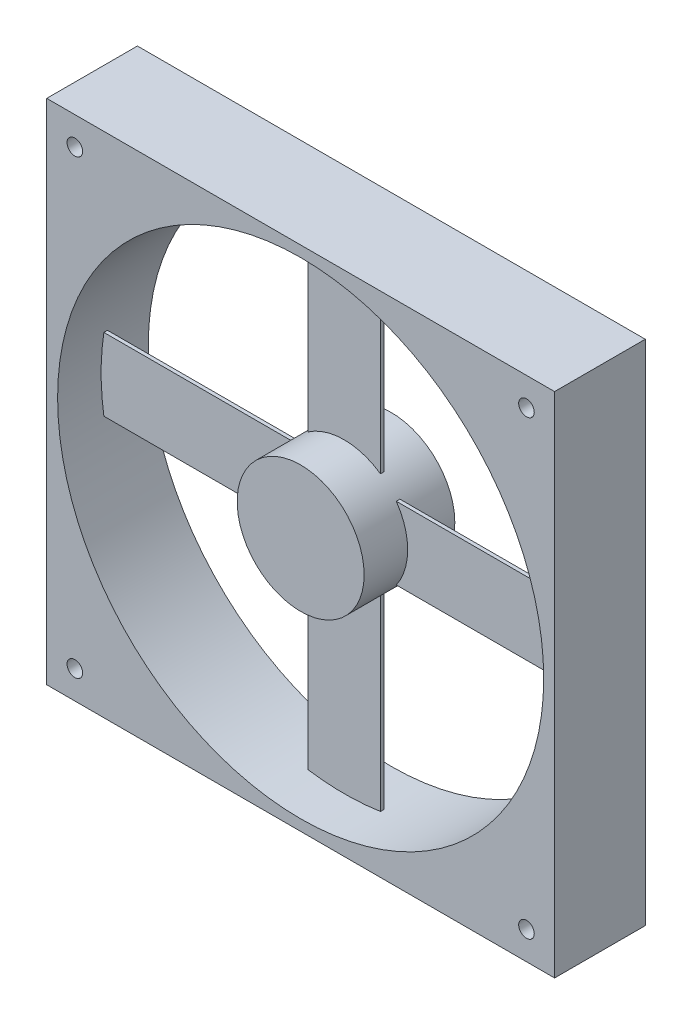
from build123d import *
from build123d.topology import SkipClean

# Parameters (mm, degrees)
SKICA1_W                 = 140
SKICA1_H                 = 140
P_IDAT_VYSUNUT_M1_DEPTH  = 25
SKICA2_R                 = 2.15
ODEBRAT_VYSUNUT_M1_DEPTH = 103.102889283
SKICA3_R                 = 67
SKICA3_R_2               = 17.5
ODEBRAT_VYSUNUT_M3_DEPTH = 103.102889283
P_IDAT_VYSUNUT_M2_DEPTH  = 0.5


with BuildPart() as part:
    # Skica1 → Přidat vysunutím1 (new body)
    with BuildSketch(Plane.XY):
        Rectangle(SKICA1_W, SKICA1_H)
    extrude(amount=P_IDAT_VYSUNUT_M1_DEPTH)

    # Skica2 → Odebrat vysunutím1 (cut, through all)
    with BuildSketch(Plane.XY.offset(25)):
        with Locations((-62.25, 62.25)):
            Circle(SKICA2_R)
        with Locations((-62.25, -62.25)):
            Circle(SKICA2_R)
        with Locations((62.25, -62.25)):
            Circle(SKICA2_R)
        with Locations((62.25, 62.25)):
            Circle(SKICA2_R)
    extrude(amount=-ODEBRAT_VYSUNUT_M1_DEPTH, mode=Mode.SUBTRACT)

    # Skica3 → Odebrat vysunutím3 (cut, through all)
    with BuildSketch(Plane.XY.offset(25)):
        Circle(SKICA3_R)
        Circle(SKICA3_R_2, mode=Mode.SUBTRACT)
    extrude(amount=-ODEBRAT_VYSUNUT_M3_DEPTH, mode=Mode.SUBTRACT)


with BuildPart() as odebrat_vysunut_m3_piece_1:
    # of the separate pieces the step leaves, piece 1, a body of its own (odebrat_vysunut_m3_pieces)
    add(part.part.solids().sort_by_distance((-70, 70, 0))[0])



with BuildPart() as odebrat_vysunut_m3_piece_2:
    # of the separate pieces the step leaves, piece 2, a body of its own (odebrat_vysunut_m3_pieces)
    add(part.part.solids().sort_by_distance((17.5, 0, 0))[0])


with BuildPart() as odebrat_vysunut_m3_piece_1_1:
    with SkipClean():  # the faces are left unmerged after this step: merging them gives an invalid solid
        add(odebrat_vysunut_m3_piece_1.part)

        add(odebrat_vysunut_m3_piece_2.part)  # Přidat vysunutím2 merges Odebrat vysunutím3 piece 2
        # Skica4 → Přidat vysunutím2 (add, symmetric)
        with BuildSketch(Plane(origin=(0, 0, 12.5), x_dir=(-1, 0, 0), z_dir=(0, 0, -1))):
            with BuildLine():
                Line((-10, 66.2495283), (-10, 14.361406616))
                ThreePointArc((-10, 14.361406616), (-12.374368671, 12.374368671), (-14.361406616, 10))
                Line((-14.361406616, 10), (-66.2495283, 10))
                ThreePointArc((-66.2495283, 10), (-67, 0), (-66.2495283, -10))
                Line((-66.2495283, -10), (-14.361406616, -10))
                ThreePointArc((-14.361406616, -10), (-12.374368671, -12.374368671), (-10, -14.361406616))
                Line((-10, -14.361406616), (-10, -66.2495283))
                ThreePointArc((-10, -66.2495283), (0, -67), (10, -66.2495283))
                Line((10, -66.2495283), (10, -14.361406616))
                ThreePointArc((10, -14.361406616), (12.374368671, -12.374368671), (14.361406616, -10))
                Line((14.361406616, -10), (66.2495283, -10))
                ThreePointArc((66.2495283, -10), (67, 0), (66.2495283, 10))
                Line((66.2495283, 10), (14.361406616, 10))
                ThreePointArc((14.361406616, 10), (12.374368671, 12.374368671), (10, 14.361406616))
                Line((10, 14.361406616), (10, 66.2495283))
                ThreePointArc((10, 66.2495283), (0, 67), (-10, 66.2495283))
            make_face()
        extrude(amount=P_IDAT_VYSUNUT_M2_DEPTH, both=True)


solid = odebrat_vysunut_m3_piece_1_1.part
